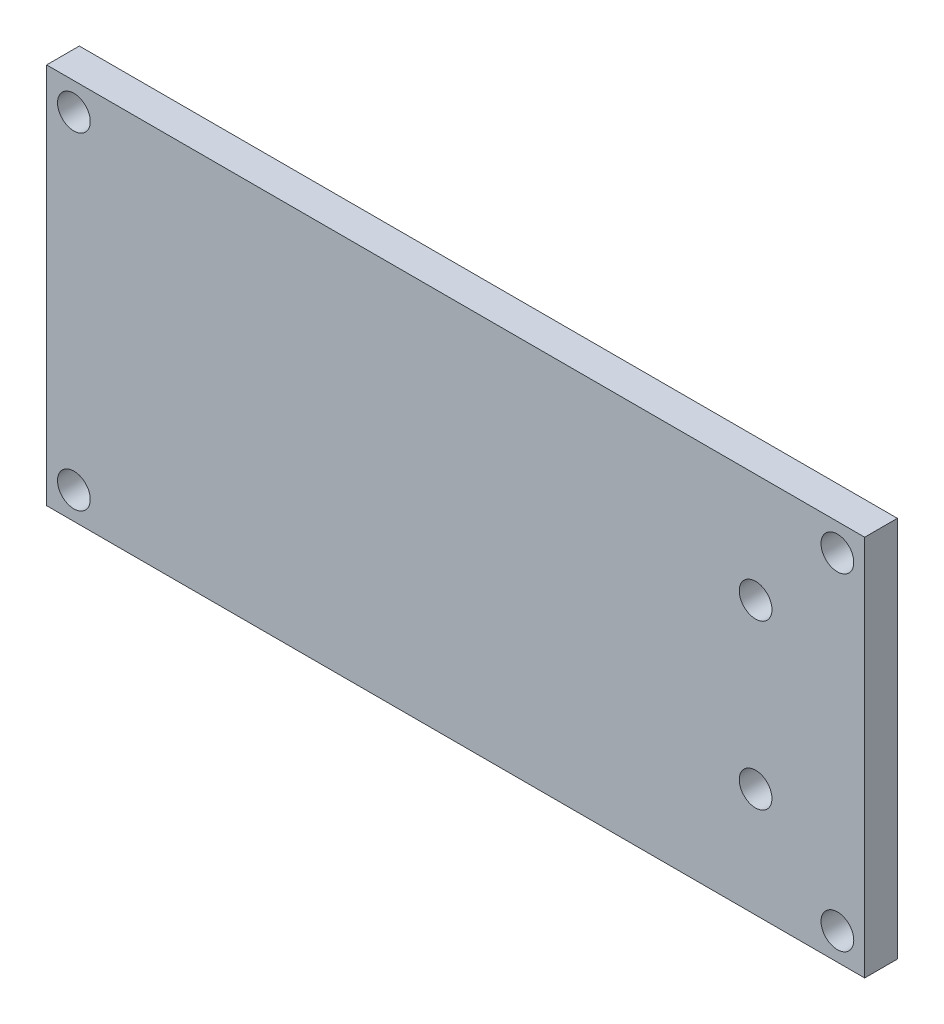
from build123d import *

# Parameters (mm, degrees)
SKETCH1_W           = 75
SKETCH1_H           = 35
SKETCH1_R           = 1.5
BOSS_EXTRUDE1_DEPTH = 3


with BuildPart() as part:
    # Sketch1 → Boss-Extrude1 (new body)
    with BuildSketch(Plane.XY):
        with Locations((37.5, 17.5)):
            Rectangle(SKETCH1_W, SKETCH1_H)
        with Locations((2.5, 32.5)):
            Circle(SKETCH1_R, mode=Mode.SUBTRACT)
        with Locations((2.5, 2.5)):
            Circle(SKETCH1_R, mode=Mode.SUBTRACT)
        with Locations((72.5, 2.5)):
            Circle(SKETCH1_R, mode=Mode.SUBTRACT)
        with Locations((72.5, 32.5)):
            Circle(SKETCH1_R, mode=Mode.SUBTRACT)
        with Locations((65, 10)):
            Circle(SKETCH1_R, mode=Mode.SUBTRACT)
        with Locations((65, 25)):
            Circle(SKETCH1_R, mode=Mode.SUBTRACT)
    extrude(amount=BOSS_EXTRUDE1_DEPTH)


solid = part.part
